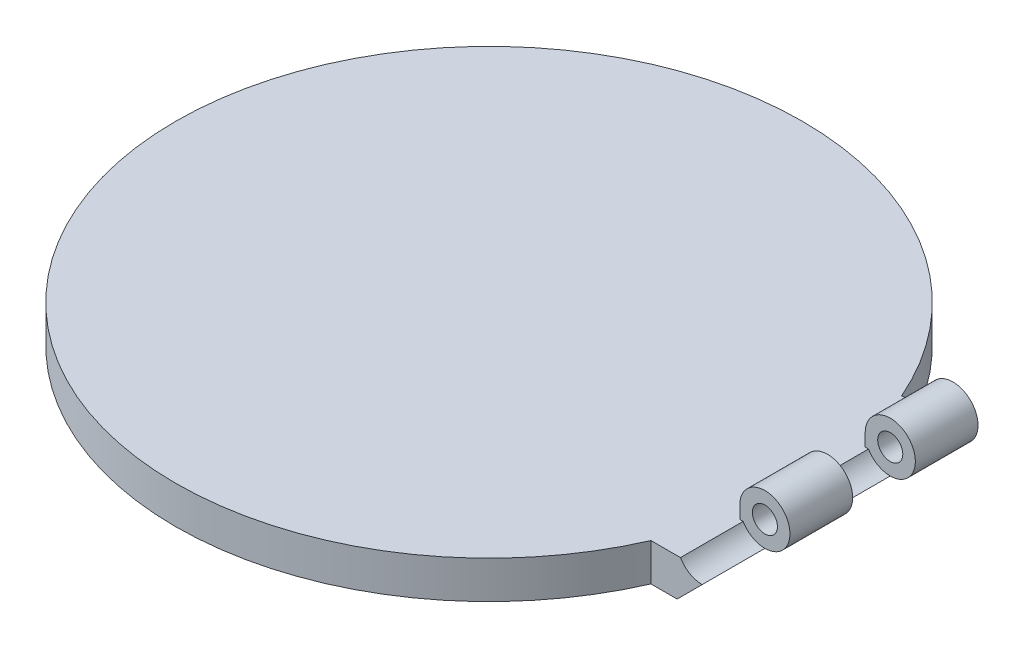
from build123d import *

# Parameters (mm, degrees)
SKETCH1_R                = 25
BOSS_EXTRUDE1_DEPTH      = 3
BOSS_EXTRUDE2_DEPTH      = 10
BOSS_EXTRUDE2_DEPTH_BACK = 10
BOSS_EXTRUDE3_REACH      = 58.223
BOSS_EXTRUDE3_END_RADIUS = 25
SKETCH3_W                = 20
SKETCH3_H                = 3
SKETCH6_R                = 1
CUT_EXTRUDE1_DEPTH       = 20
CUT_EXTRUDE2_START       = -5
CUT_EXTRUDE2_DEPTH       = 5
LPATTERN1_COUNT          = 2
LPATTERN1_PITCH          = 10


with BuildPart() as part:
    # Sketch1 → Boss-Extrude1 (new body)
    with BuildSketch(Plane(origin=(0, 0, 0), x_dir=(1, 0, 0), z_dir=(0, 1, 0))):
        with Locations(Location((0, 0, 0), (0, 0, 270))):
            Circle(SKETCH1_R)
    extrude(amount=BOSS_EXTRUDE1_DEPTH)



with BuildPart() as body_2:
    # Sketch2 → Boss-Extrude2 (new, two sides: drawn at the far end of the back side and taken through both)
    with BuildSketch(Plane.XY.offset(-BOSS_EXTRUDE2_DEPTH_BACK)):
        with BuildLine():
            Line((25, 3), (25, 4))
            ThreePointArc((25, 4), (28.414213562, 5.414213562), (27, 2))
            Line((27, 2), (25, 0))
            Line((25, 0), (25, 3))
        make_face()
    extrude(amount=BOSS_EXTRUDE2_DEPTH + BOSS_EXTRUDE2_DEPTH_BACK)


with BuildPart() as part_1:
    add(part.part)

    add(body_2.part)  # Boss-Extrude3 merges body 2
    # Boss-Extrude3: up to this cylinder (the profile starts outside it)
    boss_extrude3_end = Plane(origin=(0, 1.5, 0), z_dir=(0, -1, 0)) * Cylinder(BOSS_EXTRUDE3_END_RADIUS, 167.446, mode=Mode.PRIVATE)
    # Sketch3 → Boss-Extrude3 (add, up to the surface)
    with BuildSketch(Plane.ZY.offset(-25), mode=Mode.PRIVATE) as boss_extrude3_sk1:
        with Locations((0, 1.5)):
            Rectangle(SKETCH3_W, SKETCH3_H)
    boss_extrude3_tool1 = extrude(boss_extrude3_sk1.sketch, amount=BOSS_EXTRUDE3_REACH, mode=Mode.PRIVATE) - boss_extrude3_end
    add(boss_extrude3_tool1.solids().sort_by_distance((25, 1.5, 0))[0])
    add(boss_extrude3_tool1.solids().sort_by_distance((25, 1.5, 0))[1])

    # Sketch6 → Cut-Extrude1 (cut)
    with BuildSketch(Plane.XY.offset(10)):
        with Locations((27, 4)):
            Circle(SKETCH6_R)
    extrude(amount=-CUT_EXTRUDE1_DEPTH, mode=Mode.SUBTRACT)

    # Sketch7 → Cut-Extrude2 (cut)
    with BuildSketch(Plane.XY.offset(10).offset(CUT_EXTRUDE2_START)):
        with BuildLine():
            Line((25, 3), (25.267949192, 3))
            ThreePointArc((25.267949192, 3), (28.931851653, 4.51763809), (25, 4))
            Line((25, 4), (25, 3))
        make_face()
    cut_extrude2 = extrude(amount=CUT_EXTRUDE2_DEPTH, mode=Mode.SUBTRACT)

    # LPattern1: Cut-Extrude2 ×2
    with Locations(*[(0, 0, -i * LPATTERN1_PITCH) for i in range(1, LPATTERN1_COUNT)]):
        add(cut_extrude2, mode=Mode.SUBTRACT)


solid = part_1.part
